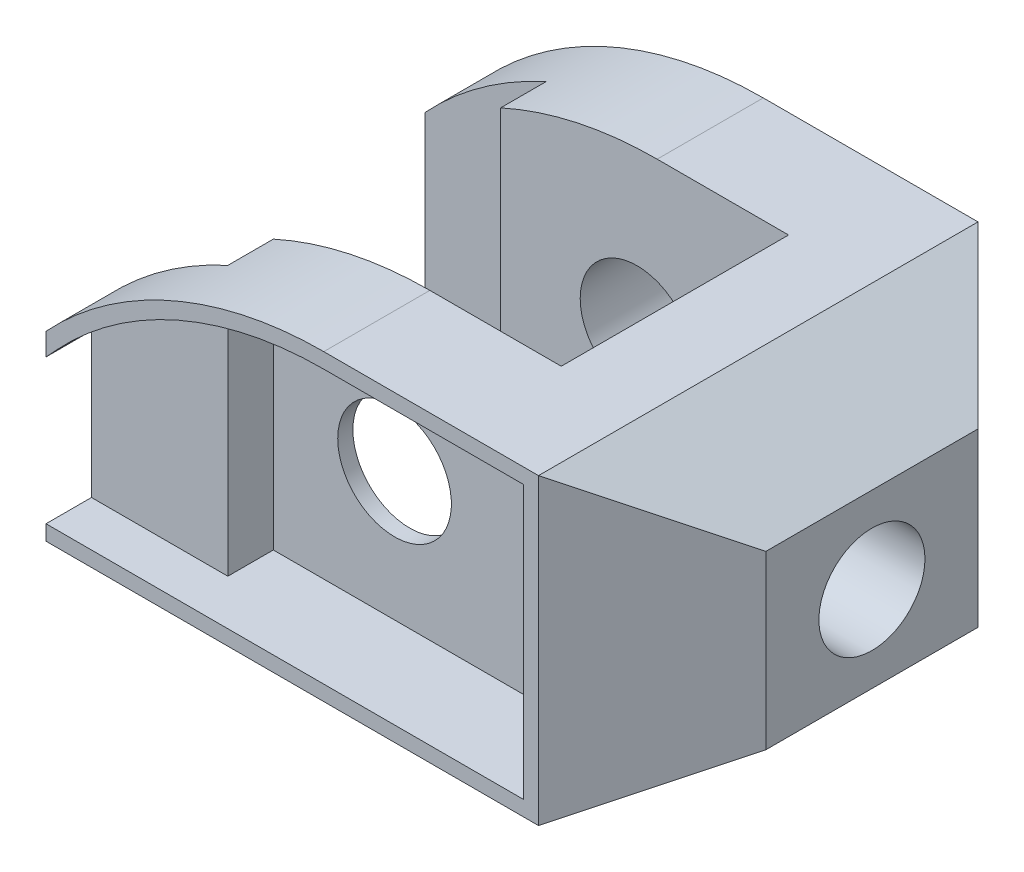
from build123d import *

# Parameters (mm, degrees)
SKETCH1_R           = 7.5
BOSS_EXTRUDE1_DEPTH = 58
CUT_EXTRUDE1_DEPTH  = 107.60206377
SKETCH3_R           = 7
CUT_EXTRUDE2_DEPTH  = 107.60206377
SKETCH5_W           = 17.33939444
SKETCH5_H           = 15
CUT_EXTRUDE3_DEPTH  = 107.602063899
CUT_EXTRUDE4_START  = -12
SKETCH6_R           = 7.5
CUT_EXTRUDE4_DEPTH  = 12
CUT_EXTRUDE5_START  = -6
CUT_EXTRUDE5_DEPTH  = 6


with BuildPart() as part:
    # Sketch1 → Boss-Extrude1 (new body)
    with BuildSketch(Plane.XY):
        with BuildLine():
            Line((0, 0), (65, 0))
            Line((65, 0), (80, 8.660254038))
            Line((80, 8.660254038), (80, 31.339745962))
            Line((80, 31.339745962), (65, 40))
            Line((65, 40), (36.66060556, 40))
            ThreePointArc((36.66060556, 40), (16.66060556, 35.82575695), (0, 24))
            Line((0, 24), (0, 0))
        make_face()
        with Locations(Location((34, 19, 0), (0, 0, 180))):
            Circle(SKETCH1_R, mode=Mode.SUBTRACT)
    extrude(amount=BOSS_EXTRUDE1_DEPTH)

    # Sketch2 → Cut-Extrude1 (cut, through all)
    with BuildSketch(Plane.XZ):
        Polygon((80, 58), (65, 58), (80, 43), align=None)
        Polygon((80, 15), (65, 0), (80, 0), align=None)
    extrude(amount=-CUT_EXTRUDE1_DEPTH, mode=Mode.SUBTRACT)

    # Sketch3 → Cut-Extrude2 (cut, through all)
    with BuildSketch(Plane(origin=(80, 0, 0), x_dir=(0, 0, -1), z_dir=(1, 0, 0))):
        with Locations((-29, 20)):
            Circle(SKETCH3_R)
    extrude(amount=-CUT_EXTRUDE2_DEPTH, mode=Mode.SUBTRACT)

    # Sketch5 → Cut-Extrude3 (cut, through all)
    with BuildSketch(Plane(origin=(0, 40, 0), x_dir=(1, 0, 0), z_dir=(0, 1, 0))):
        Polygon((16, -8), (0, -8), (0, -29), (36.66060556, -29), (36.66060556, -14), (16, -14), align=None)
        with Locations((45.33030278, -21.5)):
            Rectangle(SKETCH5_W, SKETCH5_H)
        with Locations((45.33030278, -36.5)):
            Rectangle(SKETCH5_W, SKETCH5_H)
        Polygon((36.66060556, -29), (0, -29), (0, -50), (16, -50), (16, -44), (36.66060556, -44), align=None)
    extrude(amount=-CUT_EXTRUDE3_DEPTH, mode=Mode.SUBTRACT)

    # Sketch6 → Cut-Extrude4 (cut)
    with BuildSketch(Plane.XY.offset(58).offset(CUT_EXTRUDE4_START)):
        with BuildLine():
            Line((18, 34.224221872), (18, 2))
            Line((18, 2), (63, 2))
            Line((63, 2), (63, 38))
            Line((63, 38), (36.66060556, 38))
            ThreePointArc((36.66060556, 38), (27.141221384, 37.046586751), (18, 34.224221872))
        make_face()
        with Locations(Location((34, 19, 0), (0, 0, 180))):
            Circle(SKETCH6_R, mode=Mode.SUBTRACT)
    extrude(amount=CUT_EXTRUDE4_DEPTH, mode=Mode.SUBTRACT)

    # Sketch7 → Cut-Extrude5 (cut)
    with BuildSketch(Plane.XY.offset(58).offset(CUT_EXTRUDE5_START)):
        with BuildLine():
            Line((18, 2), (18, 34.224221872))
            ThreePointArc((18, 34.224221872), (9.117311148, 29.311155325), (1.466424222, 22.64))
            Line((1.466424222, 22.64), (0, 21.058823529))
            Line((0, 21.058823529), (0, 2))
            Line((0, 2), (18, 2))
        make_face()
    extrude(amount=CUT_EXTRUDE5_DEPTH, mode=Mode.SUBTRACT)


solid = part.part
